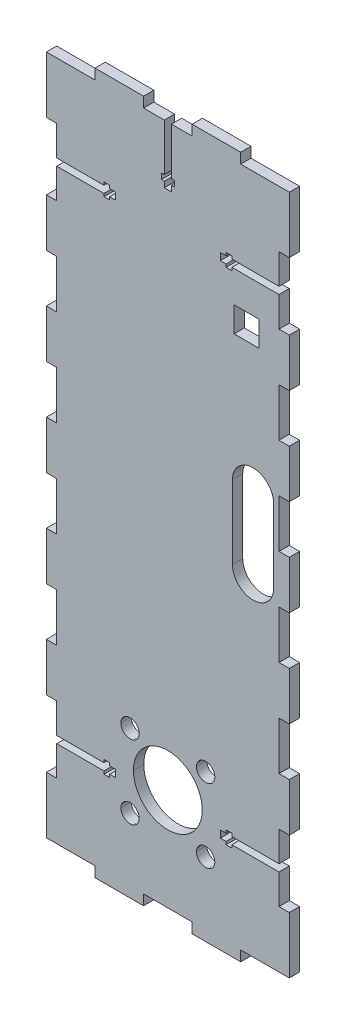
from build123d import *

# Parameters (mm, degrees)
MODEL_W             = 11.000175553
MODEL_H             = 10.999999163
BOSS_EXTRUDE1_DEPTH = 4.5


with BuildPart() as part:
    # Model → Boss-Extrude1 (new body)
    with BuildSketch(Plane.XY):
        Polygon((718.025755932, -565.527754303), (718.025755932, -552.752647917), (722.525753986, -552.752647917), (722.525718708, -528.002746812), (701.325291214, -528.002746812), (701.325291214, -523.502748758), (680.125569274, -523.502748758), (680.125569274, -528.002746812), (671.075302332, -528.002746812), (671.075302332, -548.602675974), (672.325193999, -548.602675974), (672.325193999, -551.102812084), (671.075302332, -551.102812084), (671.075302332, -553.602560139), (667.975408722, -553.602560139), (667.975408722, -551.102812084), (666.725517056, -551.102812084), (666.725517056, -548.602675974), (667.975408722, -548.602675974), (667.975408722, -528.002746812), (658.92514178, -528.002746812), (658.92514178, -523.502748758), (637.725560952, -523.502748758), (637.725560952, -528.002746812), (616.525486235, -528.002746812), (616.525486235, -552.752647917), (621.025449011, -552.752647917), (621.025449011, -565.827474303), (641.625413451, -565.827474303), (641.625413451, -564.577582637), (644.125514283, -564.577582637), (644.125514283, -565.827474303), (646.625438727, -565.827474303), (646.625438727, -568.927720691), (644.125514283, -568.927720691), (644.125514283, -570.177612357), (641.625413451, -570.177612357), (641.625413451, -568.927720691), (621.025449011, -568.927720691), (621.025449011, -582.002547077), (616.525486235, -582.002547077), (616.525486235, -603.002455683), (621.025449011, -603.002455683), (621.025449011, -624.002752344), (616.525486235, -624.002752344), (616.525486235, -645.00266095), (621.025449011, -645.00266095), (621.025449011, -666.002569556), (616.525486235, -666.002569556), (616.525486235, -687.002513439), (621.025449011, -687.002513439), (621.025449011, -708.002774823), (616.525486235, -708.002774823), (616.525486235, -729.002859818), (621.025449011, -729.002859818), (621.025449011, -750.002803701), (616.525486235, -750.002803701), (616.525486235, -771.002712307), (621.025449011, -771.002712307), (621.025449011, -784.077538693), (641.625413451, -784.077538693), (641.625413451, -782.827682304), (644.125514283, -782.827682304), (644.125514283, -784.077538693), (646.625438727, -784.077538693), (646.625438727, -787.177432303), (644.125514283, -787.177432303), (644.125514283, -788.42732397), (641.625413451, -788.42732397), (641.625413451, -787.177432303), (621.025449011, -787.177432303), (621.025449011, -800.252964244), (616.525486235, -800.252964244), (616.525486235, -825.002512572), (637.725560952, -825.002512572), (637.725560952, -829.502510626), (658.92514178, -829.502510626), (658.92514178, -825.002512572), (667.975408722, -825.002512572), (671.075302332, -825.002512572), (680.125569274, -825.002512572), (680.125569274, -829.502510626), (701.325291214, -829.502510626), (701.325291214, -825.002512572), (722.525718708, -825.002512572), (722.525753986, -800.252787855), (718.025755932, -800.252787855), (718.025755932, -787.47768147), (718.025755932, -787.177432303), (697.425438715, -787.177432303), (697.425438715, -788.42732397), (694.92569066, -788.42732397), (694.92569066, -787.177432303), (692.425237049, -787.177432303), (692.425237049, -784.077538693), (694.92569066, -784.077538693), (694.92569066, -782.827682304), (697.425438715, -782.827682304), (697.425438715, -784.077538693), (718.025755932, -784.077538693), (718.025755932, -783.777642304), (718.025755932, -771.002535918), (722.525753986, -771.002535918), (722.525753986, -750.002627312), (718.025755932, -750.002627312), (718.025755932, -729.002718707), (722.525753986, -729.002718707), (722.525753986, -708.002774823), (718.025755932, -708.002774823), (718.025755932, -687.002513439), (722.525753986, -687.002513439), (722.525753986, -666.002569556), (718.025755932, -666.002569556), (718.025755932, -645.00266095), (722.525753986, -645.00266095), (722.525753986, -624.002752344), (718.025755932, -624.002752344), (718.025755932, -603.002455683), (722.525753986, -603.002455683), (722.525753986, -582.002547077), (718.025755932, -582.002547077), (718.025755932, -569.227793469), (718.025755932, -568.927720691), (697.425438715, -568.927720691), (697.425438715, -570.177612357), (694.92569066, -570.177612357), (694.92569066, -568.927720691), (692.425237049, -568.927720691), (692.425237049, -565.827474303), (694.92569066, -565.827474303), (694.92569066, -564.577582637), (697.425438715, -564.577582637), (697.425438715, -565.827474303), (718.025755932, -565.827474303), align=None)
        with BuildLine():
            Line((715.699609821, -681.085054274), (715.699609821, -649.017765949))
            add(Edge.make_bspline(
                [(697.707943159, -649.017765949), (697.767209826, -644.081946228), (701.768344825, -640.080811229), (706.70377649, -640.080811229), (711.639913711, -640.080811229), (715.64104871, -644.081946228), (715.699609821, -649.017765949)],
                knots=[0, 0, 0, 0, 1, 1, 1, 2, 2, 2, 2], degree=3))
            Line((697.707943159, -649.017765949), (697.707943159, -681.085054274))
            add(Edge.make_bspline(
                [(697.707943159, -681.085054274), (697.707943159, -686.053223717), (701.735959825, -690.080887605), (706.70377649, -690.080887605), (711.672298711, -690.080887605), (715.699609821, -686.053223717), (715.699609821, -681.085054274)],
                knots=[0, 0, 0, 0, 1, 1, 1, 2, 2, 2, 2], degree=3))
        make_face(mode=Mode.SUBTRACT)
        with Locations((703.913939269, -588.103891659)):
            Rectangle(MODEL_W, MODEL_H, mode=Mode.SUBTRACT)
        with BuildLine():
            add(Edge.make_bspline(
                [(654.518841503, -780.523232027), (654.518841503, -772.238810362), (661.234389835, -765.523297309), (669.518811499, -765.523297309), (677.803233164, -765.523297309), (684.518746218, -772.238810362), (684.518746218, -780.523232027)],
                knots=[2, 2, 2, 2, 3, 3, 3, 4, 4, 4, 4], degree=3))
            add(Edge.make_bspline(
                [(684.518746218, -780.523232027), (684.518746218, -788.807653692), (677.803233164, -795.523202023), (669.518811499, -795.523202023), (661.234389835, -795.523202023), (654.518841503, -788.807653692), (654.518841503, -780.523232027)],
                knots=[0, 0, 0, 0, 1, 1, 1, 2, 2, 2, 2], degree=3))
        make_face(mode=Mode.SUBTRACT)
        with BuildLine():
            add(Edge.make_bspline(
                [(682.020373996, -797.456565356), (682.020373996, -795.247223968), (683.811109273, -793.456488691), (686.020133162, -793.456488691), (688.229121772, -793.456488691), (690.019892327, -795.247223968), (690.019892327, -797.456565356)],
                knots=[2, 2, 2, 2, 3, 3, 3, 4, 4, 4, 4], degree=3))
            add(Edge.make_bspline(
                [(690.019892327, -797.456565356), (690.019892327, -799.665589245), (688.229121772, -801.4566773), (686.020133162, -801.4566773), (683.811109273, -801.4566773), (682.020373996, -799.665589245), (682.020373996, -797.456565356)],
                knots=[0, 0, 0, 0, 1, 1, 1, 2, 2, 2, 2], degree=3))
        make_face(mode=Mode.SUBTRACT)
        with BuildLine():
            add(Edge.make_bspline(
                [(682.020373996, -765.353787586), (682.020373996, -763.144446198), (683.811109273, -761.353710921), (686.020133162, -761.353710921), (688.229121772, -761.353710921), (690.019892327, -763.144446198), (690.019892327, -765.353787586)],
                knots=[2, 2, 2, 2, 3, 3, 3, 4, 4, 4, 4], degree=3))
            add(Edge.make_bspline(
                [(690.019892327, -765.353787586), (690.019892327, -767.562811475), (688.229121772, -769.35389953), (686.020133162, -769.35389953), (683.811109273, -769.35389953), (682.020373996, -767.562811475), (682.020373996, -765.353787586)],
                knots=[0, 0, 0, 0, 1, 1, 1, 2, 2, 2, 2], degree=3))
        make_face(mode=Mode.SUBTRACT)
        with BuildLine():
            add(Edge.make_bspline(
                [(649.030818727, -765.353787586), (649.030818727, -763.144446198), (650.82194206, -761.353710921), (653.03124817, -761.353710921), (655.240272058, -761.353710921), (657.031007336, -763.144446198), (657.031007336, -765.353787586)],
                knots=[2, 2, 2, 2, 3, 3, 3, 4, 4, 4, 4], degree=3))
            add(Edge.make_bspline(
                [(657.031007336, -765.353787586), (657.031007336, -767.562811475), (655.240272058, -769.35389953), (653.03124817, -769.35389953), (650.82194206, -769.35389953), (649.030818727, -767.562811475), (649.030818727, -765.353787586)],
                knots=[0, 0, 0, 0, 1, 1, 1, 2, 2, 2, 2], degree=3))
        make_face(mode=Mode.SUBTRACT)
        with BuildLine():
            add(Edge.make_bspline(
                [(649.030818727, -797.456565356), (649.030818727, -795.247223968), (650.82194206, -793.456488691), (653.03124817, -793.456488691), (655.240272058, -793.456488691), (657.031007336, -795.247223968), (657.031007336, -797.456565356)],
                knots=[2, 2, 2, 2, 3, 3, 3, 4, 4, 4, 4], degree=3))
            add(Edge.make_bspline(
                [(657.031007336, -797.456565356), (657.031007336, -799.665589245), (655.240272058, -801.4566773), (653.03124817, -801.4566773), (650.82194206, -801.4566773), (649.030818727, -799.665589245), (649.030818727, -797.456565356)],
                knots=[0, 0, 0, 0, 1, 1, 1, 2, 2, 2, 2], degree=3))
        make_face(mode=Mode.SUBTRACT)
    extrude(amount=BOSS_EXTRUDE1_DEPTH)


solid = part.part
